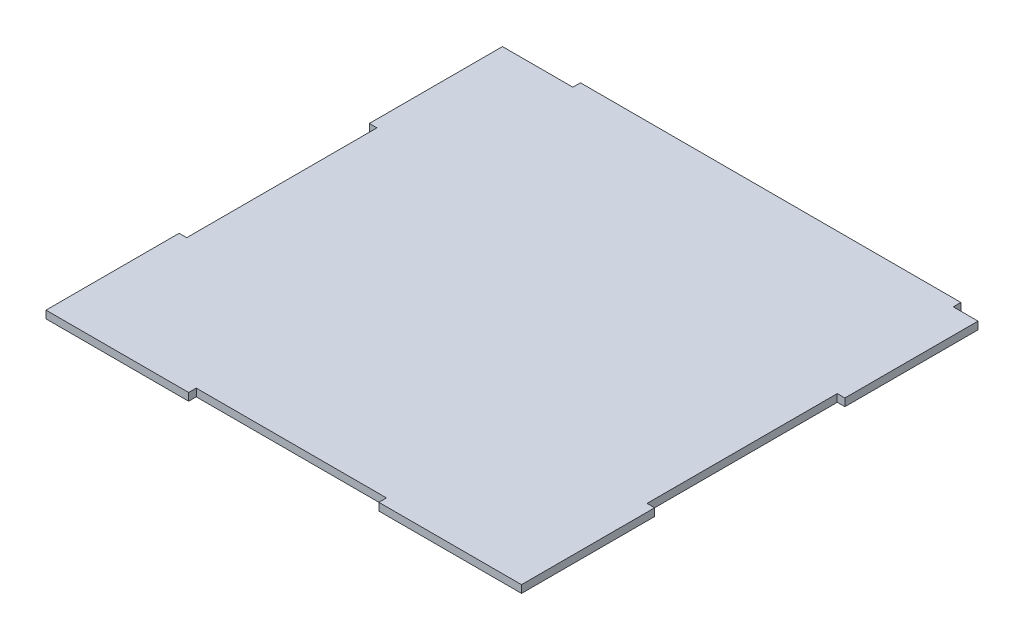
from build123d import *

# Parameters (mm, degrees)
BOSS_EXTRUDE1_DEPTH = 4


with BuildPart() as part:
    # Sketch1 → Boss-Extrude1 (new body)
    with BuildSketch(Plane(origin=(0, 0, 0), x_dir=(1, 0, 0), z_dir=(0, 1, 0))):
        Polygon((37, 240), (37, 244), (237, 244), (237, 240), (250, 240), (250, 170), (246, 170), (246, 70), (250, 70), (250, 0), (175, 0), (175, 4), (75, 4), (75, 0), (0, 0), (0, 70), (4, 70), (4, 170), (0, 170), (0, 240), align=None)
    extrude(amount=BOSS_EXTRUDE1_DEPTH)


solid = part.part
